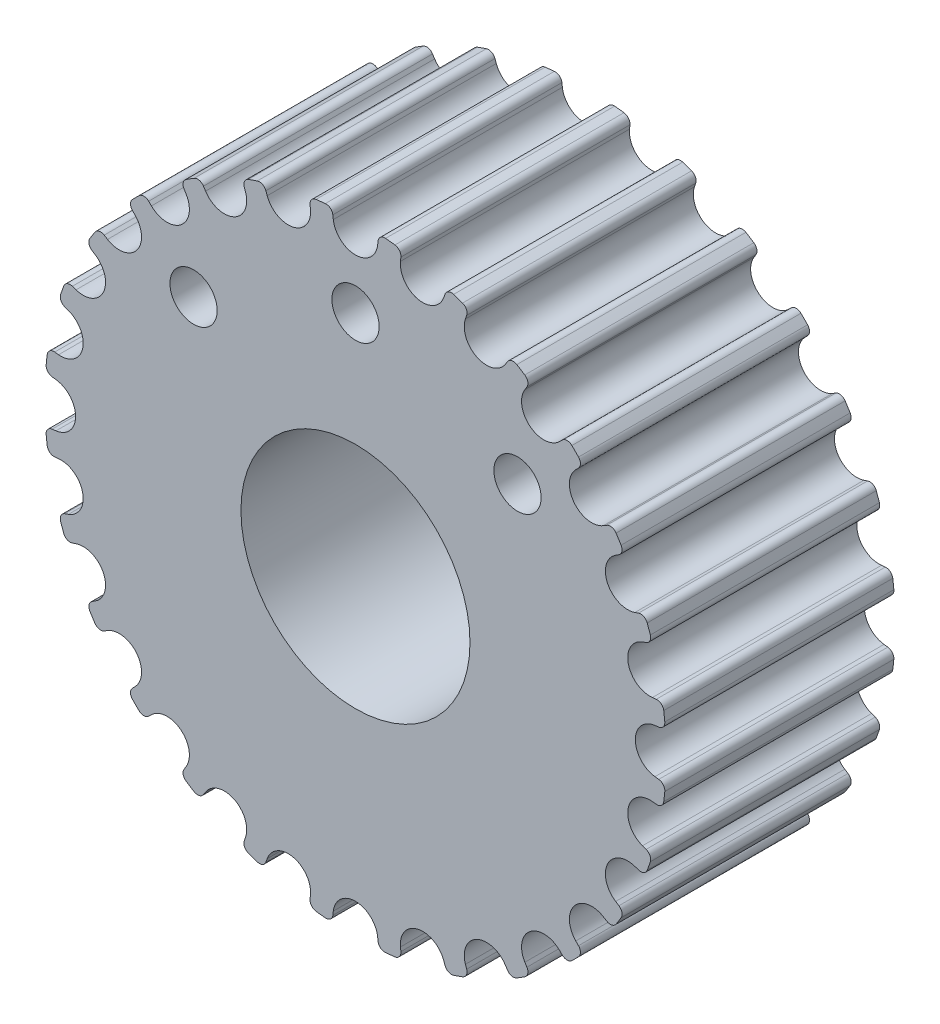
from build123d import *

# Parameters (mm, degrees)
SKETCH_2_R           = 10.5
EXTRUDE_1_DEPTH      = 16
EXTRUDE_2_DEPTH      = 4
EXTRUDE_2_DEPTH_BACK = 18
SKETCH_12_R          = 13
SKETCH_12_R_2        = 11.5
CUT_EXTRUDE_START    = -1.1
SKETCH_14_R          = 11.5
SKETCH_14_R_2        = 10.5
CUT_EXTRUDE_1_DEPTH  = 1.1
SKETCH_16_R          = 11.5
SKETCH_16_R_2        = 10.5
CUT_EXTRUDE_5_DEPTH  = 1.1
SKETCH_20_R          = 11.967322948
EXTRUDE_3_DEPTH      = 22
SKETCH_21_R          = 13
EXTRUDE_4_DEPTH      = 1
SKETCH_22_R          = 11.5
SKETCH_22_R_2        = 8.5
CUT_EXTRUDE_6_DEPTH  = 4.1
SKETCH_23_R          = 8.5
CUT_EXTRUDE_7_DEPTH  = 33.1
CUT_EXTRUDE_START_2  = -4.1
SKETCH_24_R          = 11.5
CUT_EXTRUDE_8_DEPTH  = 4.1
SKETCH_25_R          = 14.35122767
CUT_EXTRUDE_9_DEPTH  = 35
SKETCH_26_R          = 14.867897231
EXTRUDE_5_DEPTH      = 16
SKETCH_27_R          = 8
CUT_EXTRUDE_10_DEPTH = 20
SKETCH_30_R          = 12.75
SKETCH_30_R_2        = 10.5
EXTRUDE_6_DEPTH      = 3.6
SKETCH_18_R          = 1.65
CUT_EXTRUDE_15_DEPTH = 25


with BuildPart() as part:
    # 草图2 → 凸台-拉伸1 (new body)
    with BuildSketch(Plane.XY):
        with BuildLine():
            Line((1.331903556, 20.780403486), (1.298918642, 20.511762921))
            ThreePointArc((1.298918642, 20.511762921), (-0.249453355, 19.141879097), (-1.797825351, 20.511762921))
            Line((-1.797825351, 20.511762921), (-1.830810265, 20.780403486))
            ThreePointArc((-1.830810265, 20.780403486), (-2.006994407, 21.096415396), (-2.353762187, 21.19964565))
            ThreePointArc((-2.353762187, 21.19964565), (-2.679978202, 21.165383749), (-3.00563929, 21.12619674))
            ThreePointArc((-3.00563929, 21.12619674), (-3.320741986, 20.948391594), (-3.422189558, 20.601098103))
            Line((-3.422189558, 20.601098103), (-3.394569322, 20.331853084))
            ThreePointArc((-3.394569322, 20.331853084), (-4.599292572, 18.651769924), (-6.413671477, 19.642762718))
            Line((-6.413671477, 19.642762718), (-6.50560754, 19.897328069))
            ThreePointArc((-6.50560754, 19.897328069), (-6.747693643, 20.166212241), (-7.108738124, 20.189691206))
            ThreePointArc((-7.108738124, 20.189691206), (-7.419151232, 20.083698431), (-7.727927386, 19.973027513))
            ThreePointArc((-7.727927386, 19.973027513), (-7.995564432, 19.729563367), (-8.01718843, 19.36840304))
            Line((-8.01718843, 19.36840304), (-7.930348038, 19.112054636))
            ThreePointArc((-7.930348038, 19.112054636), (-8.731012687, 17.206018527), (-10.720417968, 17.768427773))
            Line((-10.720417968, 17.768427773), (-10.866695121, 17.996152941))
            ThreePointArc((-10.866695121, 17.996152941), (-11.162543977, 18.2044264), (-11.51976088, 18.146976743))
            ThreePointArc((-11.51976088, 18.146976743), (-11.798805672, 17.974568014), (-12.075213567, 17.797962688))
            ThreePointArc((-12.075213567, 17.797962688), (-12.281964525, 17.501047851), (-12.222680631, 17.144130775))
            Line((-12.222680631, 17.144130775), (-12.080974622, 16.913533367))
            ThreePointArc((-12.080974622, 16.913533367), (-12.437432001, 14.877120916), (-14.502106569, 14.982745068))
            Line((-14.502106569, 14.982745068), (-14.695389866, 15.172210962))
            ThreePointArc((-14.695389866, 15.172210962), (-15.030166378, 15.309430006), (-15.365643356, 15.173932493))
            ThreePointArc((-15.365643356, 15.173932493), (-15.599327361, 14.943753103), (-15.829506751, 14.710069098))
            ThreePointArc((-15.829506751, 14.710069098), (-15.965004264, 14.37459212), (-15.82778522, 14.039815608))
            Line((-15.82778522, 14.039815608), (-15.638319326, 13.846532311))
            ThreePointArc((-15.638319326, 13.846532311), (-15.532695174, 11.781857744), (-17.569107624, 11.425400364))
            Line((-17.569107624, 11.425400364), (-17.799705033, 11.567106373))
            ThreePointArc((-17.799705033, 11.567106373), (-18.156622109, 11.626390267), (-18.453536946, 11.41963931))
            ThreePointArc((-18.453536946, 11.41963931), (-18.630142271, 11.143231414), (-18.802551001, 10.864186622))
            ThreePointArc((-18.802551001, 10.864186622), (-18.860000658, 10.506969719), (-18.651727199, 10.211120863))
            Line((-18.651727199, 10.211120863), (-18.424002031, 10.06484371))
            ThreePointArc((-18.424002031, 10.06484371), (-17.861592784, 8.075438429), (-19.767628894, 7.27477378))
            Line((-19.767628894, 7.27477378), (-20.023977298, 7.361614172))
            ThreePointArc((-20.023977298, 7.361614172), (-20.385137624, 7.339990175), (-20.628601771, 7.072353128))
            ThreePointArc((-20.628601771, 7.072353128), (-20.739272689, 6.763576974), (-20.845265464, 6.453163866))
            ThreePointArc((-20.845265464, 6.453163866), (-20.821786499, 6.092119385), (-20.552902327, 5.850033282))
            Line((-20.552902327, 5.850033282), (-20.298336976, 5.75809722))
            ThreePointArc((-20.298336976, 5.75809722), (-19.307344182, 3.943718314), (-20.987427341, 2.738995064))
            Line((-20.987427341, 2.738995064), (-21.25667236, 2.7666153))
            ThreePointArc((-21.25667236, 2.7666153), (-21.603965852, 2.665167728), (-21.781770998, 2.350065032))
            ThreePointArc((-21.781770998, 2.350065032), (-21.820958007, 2.024403944), (-21.855219907, 1.69818793))
            ThreePointArc((-21.855219907, 1.69818793), (-21.751989654, 1.351420149), (-21.435977744, 1.175236007))
            Line((-21.435977744, 1.175236007), (-21.167337179, 1.142251093))
            ThreePointArc((-21.167337179, 1.142251093), (-19.797453355, -0.406120903), (-21.167337179, -1.9544929))
            Line((-21.167337179, -1.9544929), (-21.435977744, -1.987477814))
            ThreePointArc((-21.435977744, -1.987477814), (-21.751989654, -2.163661955), (-21.855219907, -2.510429736))
            ThreePointArc((-21.855219907, -2.510429736), (-21.820958007, -2.83664575), (-21.781770998, -3.162306838))
            ThreePointArc((-21.781770998, -3.162306838), (-21.603965852, -3.477409534), (-21.25667236, -3.578857107))
            Line((-21.25667236, -3.578857107), (-20.987427341, -3.55123687))
            ThreePointArc((-20.987427341, -3.55123687), (-19.307344182, -4.75596012), (-20.298336976, -6.570339026))
            Line((-20.298336976, -6.570339026), (-20.552902327, -6.662275089))
            ThreePointArc((-20.552902327, -6.662275089), (-20.821786499, -6.904361192), (-20.845265464, -7.265405672))
            ThreePointArc((-20.845265464, -7.265405672), (-20.739272689, -7.57581878), (-20.628601771, -7.884594935))
            ThreePointArc((-20.628601771, -7.884594935), (-20.385137624, -8.152231981), (-20.023977298, -8.173855979))
            Line((-20.023977298, -8.173855979), (-19.767628894, -8.087015586))
            ThreePointArc((-19.767628894, -8.087015586), (-17.861592784, -8.887680235), (-18.424002031, -10.877085516))
            Line((-18.424002031, -10.877085516), (-18.651727199, -11.023362669))
            ThreePointArc((-18.651727199, -11.023362669), (-18.860000658, -11.319211525), (-18.802551001, -11.676428428))
            ThreePointArc((-18.802551001, -11.676428428), (-18.630142271, -11.95547322), (-18.453536946, -12.231881116))
            ThreePointArc((-18.453536946, -12.231881116), (-18.156622109, -12.438632073), (-17.799705033, -12.379348179))
            Line((-17.799705033, -12.379348179), (-17.569107624, -12.237642171))
            ThreePointArc((-17.569107624, -12.237642171), (-15.532695174, -12.59409955), (-15.638319326, -14.658774118))
            Line((-15.638319326, -14.658774118), (-15.82778522, -14.852057414))
            ThreePointArc((-15.82778522, -14.852057414), (-15.965004264, -15.186833926), (-15.829506751, -15.522310905))
            ThreePointArc((-15.829506751, -15.522310905), (-15.599327361, -15.755994909), (-15.365643356, -15.9861743))
            ThreePointArc((-15.365643356, -15.9861743), (-15.030166378, -16.121671812), (-14.695389866, -15.984452768))
            Line((-14.695389866, -15.984452768), (-14.502106569, -15.794986874))
            ThreePointArc((-14.502106569, -15.794986874), (-12.437432001, -15.689362722), (-12.080974622, -17.725775173))
            Line((-12.080974622, -17.725775173), (-12.222680631, -17.956372582))
            ThreePointArc((-12.222680631, -17.956372582), (-12.281964525, -18.313289657), (-12.075213567, -18.610204494))
            ThreePointArc((-12.075213567, -18.610204494), (-11.798805672, -18.78680982), (-11.51976088, -18.95921855))
            ThreePointArc((-11.51976088, -18.95921855), (-11.162543977, -19.016668206), (-10.866695121, -18.808394748))
            Line((-10.866695121, -18.808394748), (-10.720417968, -18.58066958))
            ThreePointArc((-10.720417968, -18.58066958), (-8.731012687, -18.018260333), (-7.930348038, -19.924296443))
            Line((-7.930348038, -19.924296443), (-8.01718843, -20.180644846))
            ThreePointArc((-8.01718843, -20.180644846), (-7.995564432, -20.541805173), (-7.727927386, -20.785269319))
            ThreePointArc((-7.727927386, -20.785269319), (-7.419151232, -20.895940238), (-7.108738124, -21.001933013))
            ThreePointArc((-7.108738124, -21.001933013), (-6.747693643, -20.978454047), (-6.50560754, -20.709569876))
            Line((-6.50560754, -20.709569876), (-6.413671477, -20.455004524))
            ThreePointArc((-6.413671477, -20.455004524), (-4.599292572, -19.464011731), (-3.394569322, -21.14409489))
            Line((-3.394569322, -21.14409489), (-3.422189558, -21.413339909))
            ThreePointArc((-3.422189558, -21.413339909), (-3.320741986, -21.7606334), (-3.00563929, -21.938438546))
            ThreePointArc((-3.00563929, -21.938438546), (-2.679978202, -21.977625556), (-2.353762187, -22.011887456))
            ThreePointArc((-2.353762187, -22.011887456), (-2.006994407, -21.908657202), (-1.830810265, -21.592645292))
            Line((-1.830810265, -21.592645292), (-1.797825351, -21.324004727))
            ThreePointArc((-1.797825351, -21.324004727), (-0.249453355, -19.954120903), (1.298918642, -21.324004727))
            Line((1.298918642, -21.324004727), (1.331903556, -21.592645292))
            ThreePointArc((1.331903556, -21.592645292), (1.508087698, -21.908657202), (1.854855478, -22.011887456))
            ThreePointArc((1.854855478, -22.011887456), (2.181071493, -21.977625556), (2.506732581, -21.938438546))
            ThreePointArc((2.506732581, -21.938438546), (2.821835276, -21.7606334), (2.923282849, -21.413339909))
            Line((2.923282849, -21.413339909), (2.895662612, -21.14409489))
            ThreePointArc((2.895662612, -21.14409489), (4.100385862, -19.464011731), (5.914764768, -20.455004524))
            Line((5.914764768, -20.455004524), (6.006700831, -20.709569876))
            ThreePointArc((6.006700831, -20.709569876), (6.248786934, -20.978454047), (6.609831415, -21.001933013))
            ThreePointArc((6.609831415, -21.001933013), (6.920244522, -20.895940238), (7.229020677, -20.785269319))
            ThreePointArc((7.229020677, -20.785269319), (7.496657723, -20.541805173), (7.518281721, -20.180644846))
            Line((7.518281721, -20.180644846), (7.431441329, -19.924296443))
            ThreePointArc((7.431441329, -19.924296443), (8.232105978, -18.018260333), (10.221511258, -18.58066958))
            Line((10.221511258, -18.58066958), (10.367788412, -18.808394748))
            ThreePointArc((10.367788412, -18.808394748), (10.663637267, -19.016668206), (11.020854171, -18.95921855))
            ThreePointArc((11.020854171, -18.95921855), (11.299898962, -18.78680982), (11.576306858, -18.610204494))
            ThreePointArc((11.576306858, -18.610204494), (11.783057816, -18.313289657), (11.723773921, -17.956372582))
            Line((11.723773921, -17.956372582), (11.582067913, -17.725775173))
            ThreePointArc((11.582067913, -17.725775173), (11.938525292, -15.689362722), (14.00319986, -15.794986874))
            Line((14.00319986, -15.794986874), (14.196483156, -15.984452768))
            ThreePointArc((14.196483156, -15.984452768), (14.531259668, -16.121671812), (14.866736647, -15.9861743))
            ThreePointArc((14.866736647, -15.9861743), (15.100420651, -15.755994909), (15.330600042, -15.522310905))
            ThreePointArc((15.330600042, -15.522310905), (15.466097554, -15.186833926), (15.32887851, -14.852057414))
            Line((15.32887851, -14.852057414), (15.139412616, -14.658774118))
            ThreePointArc((15.139412616, -14.658774118), (15.033788465, -12.59409955), (17.070200915, -12.237642171))
            Line((17.070200915, -12.237642171), (17.300798324, -12.379348179))
            ThreePointArc((17.300798324, -12.379348179), (17.657715399, -12.438632073), (17.954630236, -12.231881116))
            ThreePointArc((17.954630236, -12.231881116), (18.131235562, -11.95547322), (18.303644292, -11.676428428))
            ThreePointArc((18.303644292, -11.676428428), (18.361093948, -11.319211525), (18.15282049, -11.023362669))
            Line((18.15282049, -11.023362669), (17.925095322, -10.877085516))
            ThreePointArc((17.925095322, -10.877085516), (17.362686075, -8.887680235), (19.268722185, -8.087015586))
            Line((19.268722185, -8.087015586), (19.525070588, -8.173855979))
            ThreePointArc((19.525070588, -8.173855979), (19.886230915, -8.152231981), (20.129695061, -7.884594935))
            ThreePointArc((20.129695061, -7.884594935), (20.24036598, -7.57581878), (20.346358755, -7.265405672))
            ThreePointArc((20.346358755, -7.265405672), (20.32287979, -6.904361192), (20.053995618, -6.662275089))
            Line((20.053995618, -6.662275089), (19.799430267, -6.570339026))
            ThreePointArc((19.799430267, -6.570339026), (18.808437473, -4.75596012), (20.488520632, -3.55123687))
            Line((20.488520632, -3.55123687), (20.757765651, -3.578857107))
            ThreePointArc((20.757765651, -3.578857107), (21.105059142, -3.477409534), (21.282864289, -3.162306838))
            ThreePointArc((21.282864289, -3.162306838), (21.322051298, -2.83664575), (21.356313198, -2.510429736))
            ThreePointArc((21.356313198, -2.510429736), (21.253082944, -2.163661955), (20.937071035, -1.987477814))
            Line((20.937071035, -1.987477814), (20.66843047, -1.9544929))
            ThreePointArc((20.66843047, -1.9544929), (19.298546645, -0.406120903), (20.66843047, 1.142251093))
            Line((20.66843047, 1.142251093), (20.937071035, 1.175236007))
            ThreePointArc((20.937071035, 1.175236007), (21.253082944, 1.351420149), (21.356313198, 1.69818793))
            ThreePointArc((21.356313198, 1.69818793), (21.322051298, 2.024403944), (21.282864289, 2.350065032))
            ThreePointArc((21.282864289, 2.350065032), (21.105059142, 2.665167728), (20.757765651, 2.7666153))
            Line((20.757765651, 2.7666153), (20.488520632, 2.738995064))
            ThreePointArc((20.488520632, 2.738995064), (18.808437473, 3.943718314), (19.799430267, 5.75809722))
            Line((19.799430267, 5.75809722), (20.053995618, 5.850033282))
            ThreePointArc((20.053995618, 5.850033282), (20.32287979, 6.092119385), (20.346358755, 6.453163866))
            ThreePointArc((20.346358755, 6.453163866), (20.24036598, 6.763576974), (20.129695061, 7.072353128))
            ThreePointArc((20.129695061, 7.072353128), (19.886230915, 7.339990175), (19.525070588, 7.361614172))
            Line((19.525070588, 7.361614172), (19.268722185, 7.27477378))
            ThreePointArc((19.268722185, 7.27477378), (17.362686075, 8.075438429), (17.925095322, 10.06484371))
            Line((17.925095322, 10.06484371), (18.15282049, 10.211120863))
            ThreePointArc((18.15282049, 10.211120863), (18.361093948, 10.506969719), (18.303644292, 10.864186622))
            ThreePointArc((18.303644292, 10.864186622), (18.131235562, 11.143231414), (17.954630236, 11.41963931))
            ThreePointArc((17.954630236, 11.41963931), (17.657715399, 11.626390267), (17.300798324, 11.567106373))
            Line((17.300798324, 11.567106373), (17.070200915, 11.425400364))
            ThreePointArc((17.070200915, 11.425400364), (15.033788465, 11.781857744), (15.139412616, 13.846532311))
            Line((15.139412616, 13.846532311), (15.32887851, 14.039815608))
            ThreePointArc((15.32887851, 14.039815608), (15.466097554, 14.37459212), (15.330600042, 14.710069098))
            ThreePointArc((15.330600042, 14.710069098), (15.100420651, 14.943753103), (14.866736647, 15.173932493))
            ThreePointArc((14.866736647, 15.173932493), (14.531259668, 15.309430006), (14.196483156, 15.172210962))
            Line((14.196483156, 15.172210962), (14.00319986, 14.982745068))
            ThreePointArc((14.00319986, 14.982745068), (11.938525292, 14.877120916), (11.582067913, 16.913533367))
            Line((11.582067913, 16.913533367), (11.723773921, 17.144130775))
            ThreePointArc((11.723773921, 17.144130775), (11.783057816, 17.501047851), (11.576306858, 17.797962688))
            ThreePointArc((11.576306858, 17.797962688), (11.299898962, 17.974568014), (11.020854171, 18.146976743))
            ThreePointArc((11.020854171, 18.146976743), (10.663637267, 18.2044264), (10.367788412, 17.996152941))
            Line((10.367788412, 17.996152941), (10.221511258, 17.768427773))
            ThreePointArc((10.221511258, 17.768427773), (8.232105978, 17.206018527), (7.431441329, 19.112054636))
            Line((7.431441329, 19.112054636), (7.518281721, 19.36840304))
            ThreePointArc((7.518281721, 19.36840304), (7.496657723, 19.729563367), (7.229020677, 19.973027513))
            ThreePointArc((7.229020677, 19.973027513), (6.920244522, 20.083698431), (6.609831415, 20.189691206))
            ThreePointArc((6.609831415, 20.189691206), (6.248786934, 20.166212241), (6.006700831, 19.897328069))
            Line((6.006700831, 19.897328069), (5.914764768, 19.642762718))
            ThreePointArc((5.914764768, 19.642762718), (4.100385862, 18.651769924), (2.895662612, 20.331853084))
            Line((2.895662612, 20.331853084), (2.923282849, 20.601098103))
            ThreePointArc((2.923282849, 20.601098103), (2.821835276, 20.948391594), (2.506732581, 21.12619674))
            ThreePointArc((2.506732581, 21.12619674), (2.181071493, 21.165383749), (1.854855478, 21.19964565))
            ThreePointArc((1.854855478, 21.19964565), (1.508087698, 21.096415396), (1.331903556, 20.780403486))
        make_face()
        with Locations((-0.245789015, -0.367741944)):
            Circle(SKETCH_2_R, mode=Mode.SUBTRACT)
    extrude(amount=EXTRUDE_1_DEPTH)


with BuildPart() as part_1:
    # Move Body 1: moved
    add(part.part.moved(Location((-21.775119277, 0, 0))))

    # 草图12 → 凸台-拉伸2 (add, two sides: drawn at the far end of the back side and taken through both)
    with BuildSketch(Plane.XY.offset(16).offset(-EXTRUDE_2_DEPTH_BACK)):
        with Locations((-22.024572632, -0.309578045)):
            Circle(SKETCH_12_R)
        with Locations((-22.024572632, -0.309578045)):
            Circle(SKETCH_12_R_2, mode=Mode.SUBTRACT)
    extrude(amount=EXTRUDE_2_DEPTH + EXTRUDE_2_DEPTH_BACK)

    # 草图14 → 切除-拉伸1 (cut)
    with BuildSketch(Plane.XY.offset(16).offset(CUT_EXTRUDE_START)):
        with Locations((-22.024572632, -0.309578045)):
            Circle(SKETCH_14_R)
        with Locations((-22.020908292, -0.367741944)):
            Circle(SKETCH_14_R_2, mode=Mode.SUBTRACT)
    extrude(amount=CUT_EXTRUDE_1_DEPTH, mode=Mode.SUBTRACT)

    # 草图16 → 切除-拉伸5 (cut)
    with BuildSketch(Plane(origin=(0, 0, 0), x_dir=(-1, 0, 0), z_dir=(0, 0, -1))):
        with Locations(Location((22.024572632, -0.309578045, 0), (0, 0, 180))):
            Circle(SKETCH_16_R)
        with Locations((22.020908292, -0.367741944)):
            Circle(SKETCH_16_R_2, mode=Mode.SUBTRACT)
    extrude(amount=-CUT_EXTRUDE_5_DEPTH, mode=Mode.SUBTRACT)

    # 草图20 → 凸台-拉伸3 (add)
    with BuildSketch(Plane.XY.offset(20)):
        with Locations((-22.024572632, -0.309578045)):
            Circle(SKETCH_20_R)
    extrude(amount=-EXTRUDE_3_DEPTH)

    # 草图21 → 凸台-拉伸4 (add)
    with BuildSketch(Plane(origin=(0, 0, -2), x_dir=(-1, 0, 0), z_dir=(0, 0, -1))):
        with Locations(Location((22.024572632, -0.309578045, 0), (0, 0, 180))):
            Circle(SKETCH_21_R)
    extrude(amount=EXTRUDE_4_DEPTH)

    # 草图22 → 切除-拉伸6 (cut)
    with BuildSketch(Plane(origin=(0, 0, -3), x_dir=(-1, 0, 0), z_dir=(0, 0, -1))):
        with Locations((22.024572632, -0.309578045)):
            Circle(SKETCH_22_R)
        with Locations((22.024572632, -0.309578045)):
            Circle(SKETCH_22_R_2, mode=Mode.SUBTRACT)
    extrude(amount=-CUT_EXTRUDE_6_DEPTH, mode=Mode.SUBTRACT)

    # 草图23 → 切除-拉伸7 (cut)
    with BuildSketch(Plane(origin=(0, 0, -3), x_dir=(-1, 0, 0), z_dir=(0, 0, -1))):
        with Locations((22.024572632, -0.309578045)):
            Circle(SKETCH_23_R)
    extrude(amount=-CUT_EXTRUDE_7_DEPTH, mode=Mode.SUBTRACT)

    # 草图24 → 切除-拉伸8 (cut)
    with BuildSketch(Plane.XY.offset(20).offset(CUT_EXTRUDE_START_2)):
        with Locations(Location((-22.024572632, -0.309578045, 0), (0, 0, 180))):
            Circle(SKETCH_24_R)
    extrude(amount=CUT_EXTRUDE_8_DEPTH, mode=Mode.SUBTRACT)

    # 草图25 → 切除-拉伸9 (cut)
    with BuildSketch(Plane(origin=(0, 0, -3), x_dir=(-1, 0, 0), z_dir=(0, 0, -1))):
        with Locations(Location((22.024572632, -0.309578045, 0), (0, 0, 180))):
            Circle(SKETCH_25_R)
    extrude(amount=-CUT_EXTRUDE_9_DEPTH, mode=Mode.SUBTRACT)

    # 草图26 → 凸台-拉伸5 (add)
    with BuildSketch(Plane(origin=(0, 0, 0), x_dir=(-1, 0, 0), z_dir=(0, 0, -1))):
        with Locations((22.024572632, -0.309578045)):
            Circle(SKETCH_26_R)
    extrude(amount=-EXTRUDE_5_DEPTH)

    # 草图27 → 切除-拉伸10 (cut)
    with BuildSketch(Plane(origin=(0, 0, 0), x_dir=(-1, 0, 0), z_dir=(0, 0, -1))):
        with Locations((22.024572632, -0.309578045)):
            Circle(SKETCH_27_R)
    extrude(amount=-CUT_EXTRUDE_10_DEPTH, mode=Mode.SUBTRACT)

    # 草图30 → 凸台-拉伸6 (add)
    with BuildSketch(Plane(origin=(0, 0, 0), x_dir=(-1, 0, 0), z_dir=(0, 0, -1))):
        with Locations(Location((22.024572632, -0.309578045, 0), (0, 0, 180))):
            Circle(SKETCH_30_R)
        with Locations((22.024572632, -0.309578045)):
            Circle(SKETCH_30_R_2, mode=Mode.SUBTRACT)
    extrude(amount=EXTRUDE_6_DEPTH)

    # 草图18 → 切除-拉伸15 (cut)
    with BuildSketch(Plane(origin=(0, 0, 0), x_dir=(-1, 0, 0), z_dir=(0, 0, -1))):
        with Locations((10.707199793, 10.945966555)):
            Circle(SKETCH_18_R)
        with Locations((22.020908292, 15.632258056)):
            Circle(SKETCH_18_R)
        with Locations((33.334616791, 10.945966555)):
            Circle(SKETCH_18_R)
    extrude(amount=-CUT_EXTRUDE_15_DEPTH, mode=Mode.SUBTRACT)


solid = part_1.part
